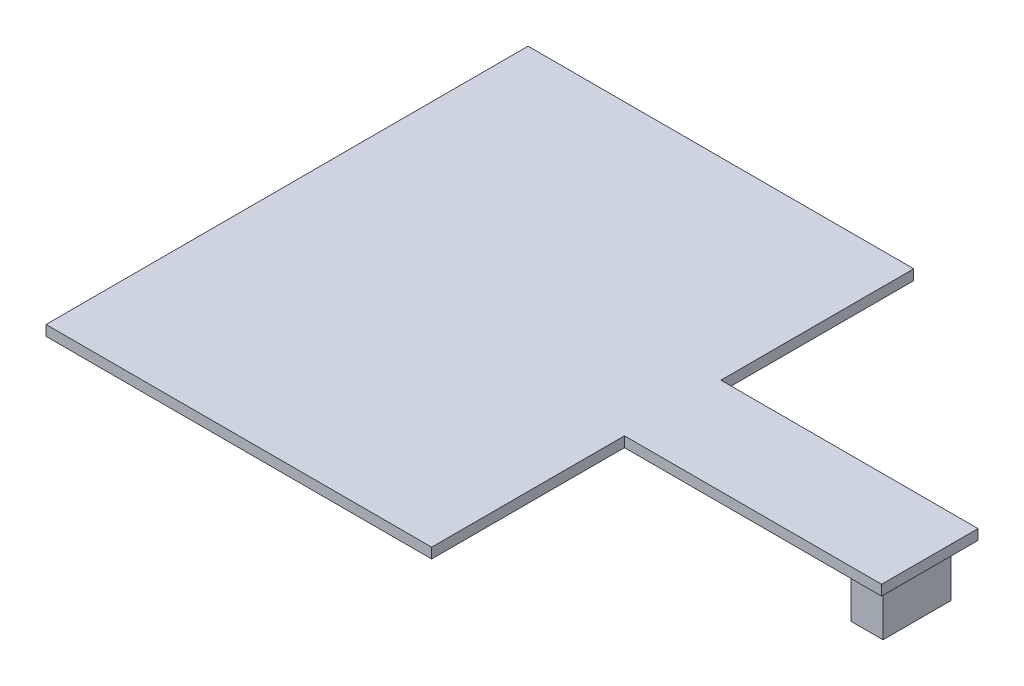
from build123d import *

# Parameters (mm, degrees)
SKETCH1_W           = 60
SKETCH1_H           = 75
SKETCH1_W_2         = 40
SKETCH1_H_2         = 15
BOSS_EXTRUDE1_DEPTH = 1.6
SKETCH2_W           = 5
SKETCH2_H           = 10.56
BOSS_EXTRUDE2_DEPTH = 8


with BuildPart() as part:
    # Sketch1 → Boss-Extrude1 (new body)
    with BuildSketch(Plane(origin=(0, 0, 0), x_dir=(1, 0, 0), z_dir=(0, 1, 0))):
        Rectangle(SKETCH1_W, SKETCH1_H)
        with Locations((50, 0)):
            Rectangle(SKETCH1_W_2, SKETCH1_H_2)
    extrude(amount=-BOSS_EXTRUDE1_DEPTH)

    # Sketch2 → Boss-Extrude2 (add)
    with BuildSketch(Plane.XZ.offset(1.6)):
        with Locations((65.5, 0)):
            Rectangle(SKETCH2_W, SKETCH2_H)
    extrude(amount=BOSS_EXTRUDE2_DEPTH)


solid = part.part
